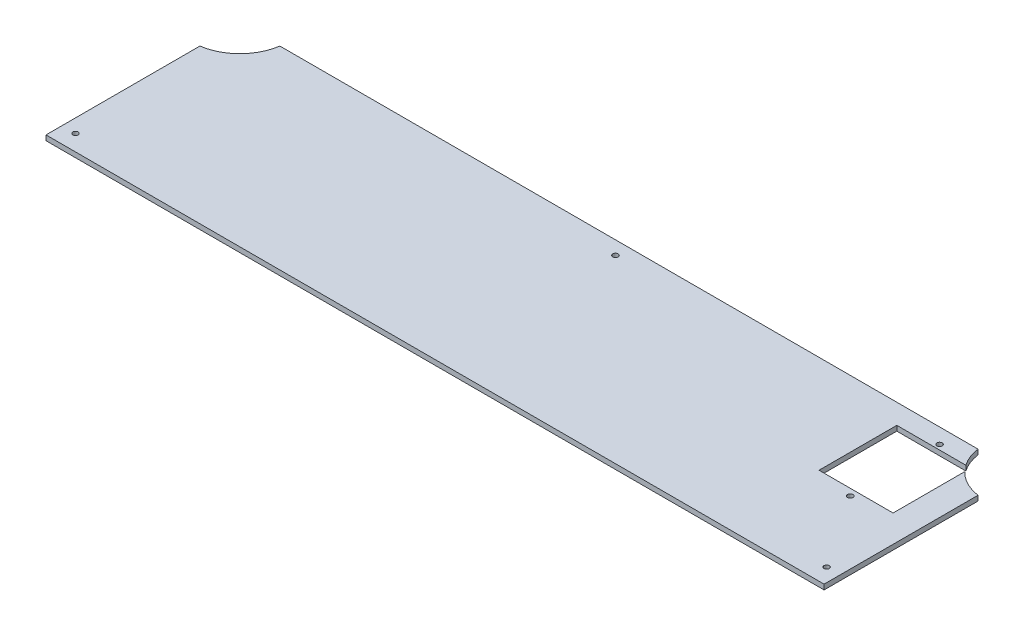
from build123d import *

# Parameters (mm, degrees)
CROQUIS1_R              = 1.6
CROQUIS1_R_2            = 1.55
SALIENTE_EXTRUIR1_DEPTH = 3


with BuildPart() as part:
    # Croquis1 → Saliente-Extruir1 (new body)
    with BuildSketch(Plane(origin=(0, 0, 0), x_dir=(1, 0, 0), z_dir=(0, 1, 0))):
        with BuildLine():
            Line((230.847543198, -52.68112687), (230.847543198, 34.350751843))
            ThreePointArc((230.847543198, 34.350751843), (222.131671295, 37.117490889), (214.7720715, 42.544972702))
            Line((214.7720715, 42.544972702), (214.7720715, 0.063564764))
            Line((214.7720715, 0.063564764), (170.847543198, 0.063564764))
            Line((170.847543198, 0.063564764), (170.847543198, 46.193023152))
            Line((170.847543198, 46.193023152), (211.779688747, 46.193023152))
            ThreePointArc((211.779688747, 46.193023152), (208.772718477, 51.86045172), (207.134730277, 58.063564764))
            Line((207.134730277, 58.063564764), (-206.939643881, 58.063564764))
            ThreePointArc((-206.939643881, 58.063564764), (-214.853466929, 42.264574891), (-230.652456802, 34.350751843))
            Line((-230.652456802, 34.350751843), (-230.652456802, -52.936435236))
            Line((-230.652456802, -52.936435236), (-230.652456802, -56.936435236))
            Line((-230.652456802, -56.936435236), (230.847543198, -56.936435236))
            Line((230.847543198, -56.936435236), (230.847543198, -52.68112687))
        make_face()
        with Locations(Location((193.347543198, -3.936435236, 0), (0, 0, 270))):
            Circle(CROQUIS1_R, mode=Mode.SUBTRACT)
        with Locations(Location((193.347543198, 49.063564764, 0), (0, 0, 270))):
            Circle(CROQUIS1_R, mode=Mode.SUBTRACT)
        with Locations(Location((222.847543198, -47.436435236, 0), (0, 0, 270))):
            Circle(CROQUIS1_R_2, mode=Mode.SUBTRACT)
        with Locations(Location((0.097543198, 50.063564764, 0), (0, 0, 270))):
            Circle(CROQUIS1_R, mode=Mode.SUBTRACT)
        with Locations(Location((-222.652456802, -47.436435236, 0), (0, 0, 270))):
            Circle(CROQUIS1_R_2, mode=Mode.SUBTRACT)
    extrude(amount=SALIENTE_EXTRUIR1_DEPTH)


solid = part.part
